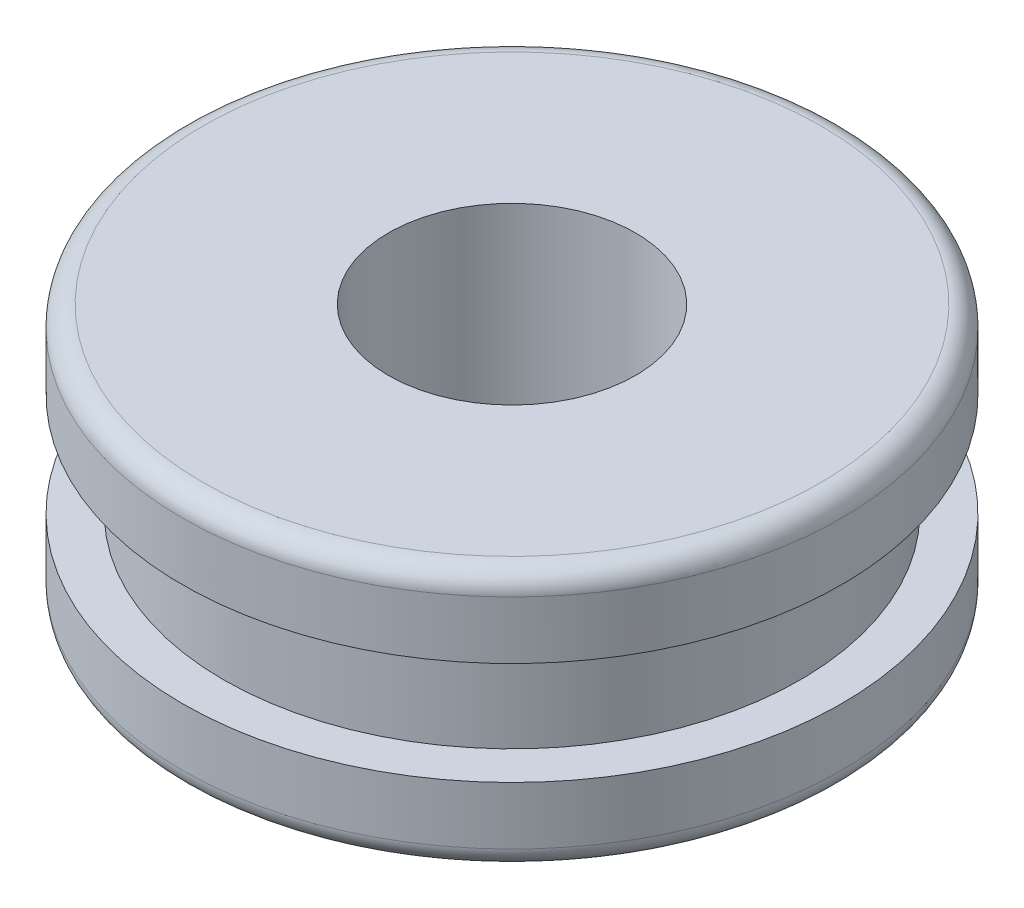
from build123d import *

# Parameters (mm, degrees)
CROQUIS_BASE_R           = 3.5
SALIENTE_EXTRUIR3_DEPTH  = 1.25
CROQUIS_CAP_R            = 4
SALIENTE_EXTRUIR4_DEPTH  = 0.95
REDONDEO1_R              = 0.25
REDONDEO1_OF_SIMETR_A1_R = 0.25
CROQUIS_BARRENO_R        = 1.5
CORTAR_EXTRUIR1_DEPTH    = 7.474758683


with BuildPart() as part:
    # Croquis base → Saliente-Extruir3 (new body)
    with BuildSketch(Plane(origin=(0, 0, 0), x_dir=(1, 0, 0), z_dir=(0, 1, 0))):
        with Locations(Location((0, 0, 0), (0, 0, 270))):
            Circle(CROQUIS_BASE_R)
    extrude(amount=SALIENTE_EXTRUIR3_DEPTH)

    # Croquis cap → Saliente-Extruir4 (add)
    with BuildSketch(Plane(origin=(0, 1.25, 0), x_dir=(1, 0, 0), z_dir=(0, 1, 0))):
        with Locations(Location((0, 0, 0), (0, 0, 90))):
            Circle(CROQUIS_CAP_R)
    saliente_extruir4 = extrude(amount=SALIENTE_EXTRUIR4_DEPTH)

    # Redondeo1
    redondeo1_edges = [part.edges().sort_by_distance(p)[0] for p in [
        (0, 2.2, 4),
    ]]
    fillet(redondeo1_edges, radius=REDONDEO1_R)

    # Simetría1: Saliente-Extruir4 across plane
    add(saliente_extruir4.mirror(Plane.ZX.offset(0.625)))

    # Redondeo1 of Simetría1
    redondeo1_of_simetr_a1_edges = [part.edges().sort_by_distance(p)[0] for p in [
        (0, -0.95, 4),
    ]]
    fillet(redondeo1_of_simetr_a1_edges, radius=REDONDEO1_OF_SIMETR_A1_R)

    # Croquis barreno → Cortar-Extruir1 (cut, through all)
    with BuildSketch(Plane(origin=(0, 2.2, 0), x_dir=(1, 0, 0), z_dir=(0, 1, 0))):
        with Locations(Location((0, 0, 0), (0, 0, 270))):
            Circle(CROQUIS_BARRENO_R)
    extrude(amount=-CORTAR_EXTRUIR1_DEPTH, mode=Mode.SUBTRACT)


solid = part.part
